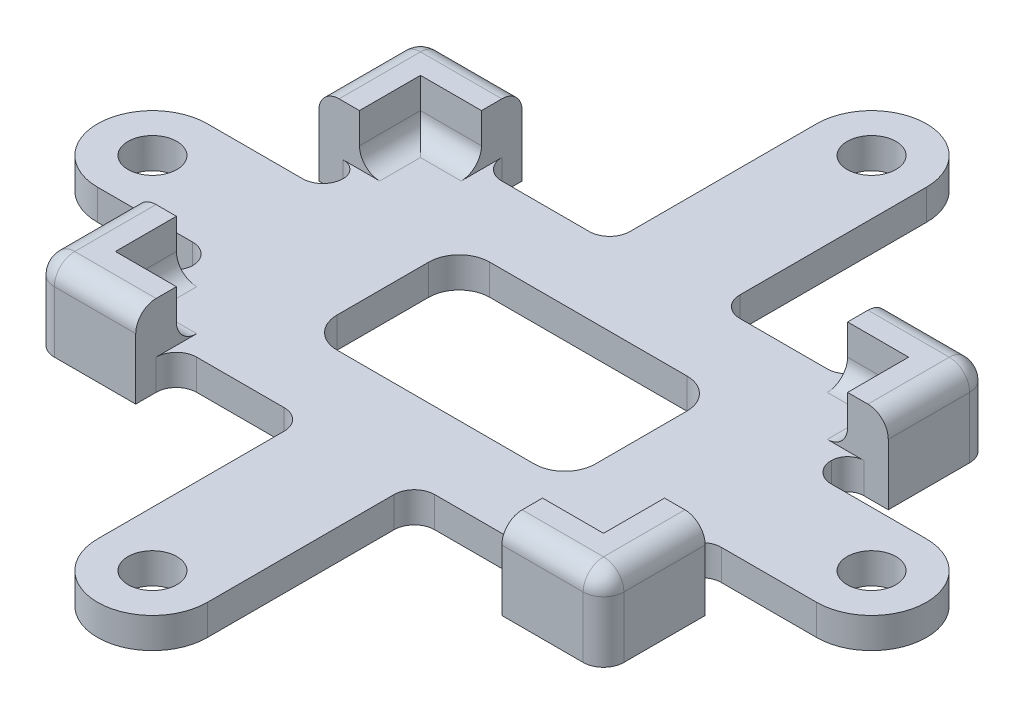
from build123d import *

# Parameters (mm, degrees)
SKETCH1_W            = 24
SKETCH1_H            = 15
BOSS_EXTRUDE1_DEPTH  = 0.75
BOSS_EXTRUDE2_START  = -1.5
BOSS_EXTRUDE2_DEPTH  = 4
MIRROR2_START        = -1.5
MIRROR2_COPY_1_DEPTH = 4
SKETCH3_R            = 1.2
BOSS_EXTRUDE3_DEPTH  = 1.5
FILLET1_R            = 1
BOSS_EXTRUDE4_DEPTH  = 1.5
SKETCH5_W            = 12.692307692
SKETCH5_H            = 7.5
CUT_EXTRUDE1_DEPTH   = 1.5
FILLET2_R            = 1.5


with BuildPart() as part:
    # Sketch1 → Boss-Extrude1 (new, symmetric)
    with BuildSketch(Plane(origin=(0, 0, 0), x_dir=(1, 0, 0), z_dir=(0, 1, 0))):
        Rectangle(SKETCH1_W, SKETCH1_H)
    extrude(amount=BOSS_EXTRUDE1_DEPTH, both=True)

    # Sketch2 → Boss-Extrude2 (add)
    with BuildSketch(Plane(origin=(0, 0.75, 0), x_dir=(1, 0, 0), z_dir=(0, 1, 0)).offset(BOSS_EXTRUDE2_START)):
        Polygon((-12, 4.5), (-14, 4.5), (-14, 9.5), (-9, 9.5), (-9, 7.5), (-12, 7.5), align=None)
    boss_extrude2 = extrude(amount=BOSS_EXTRUDE2_DEPTH)

    # Mirror1: Boss-Extrude2 across plane
    add(boss_extrude2.mirror(Plane(origin=(0, 0, 0), x_dir=(0, 0, 1), z_dir=(1, 0, 0))))

    # Mirror2: Boss-Extrude2 across plane
    add(boss_extrude2.mirror(Plane.XY))

    # Mirror2 copy 1 sketch → Mirror2 copy 1 (add)
    with BuildSketch(Plane(origin=(0, 0.75, 0), x_dir=(-1, 0, 0), z_dir=(0, 1, 0)).offset(MIRROR2_START)):
        Polygon((-12, 4.5), (-14, 4.5), (-14, 9.5), (-9, 9.5), (-9, 7.5), (-12, 7.5), align=None)
    extrude(amount=MIRROR2_COPY_1_DEPTH)

    # Sketch3 → Boss-Extrude3 (add)
    # profile 1 of 4: a face of its own
    with BuildSketch(Plane(origin=(0, 0.75, 0), x_dir=(1, 0, 0), z_dir=(0, 1, 0))):
        with BuildLine():
            Line((-17.67766953, 2.7), (-12, 2.7))
            Line((-12, 2.7), (-12, -2.7))
            Line((-12, -2.7), (-17.67766953, -2.7))
            ThreePointArc((-17.67766953, -2.7), (-20.37766953, 0), (-17.67766953, 2.7))
        make_face()
        with Locations(Location((-17.67766953, 0, 0), (0, 0, 270))):
            Circle(SKETCH3_R, mode=Mode.SUBTRACT)
    # profile 2 of 4: a face of its own
    with BuildSketch(Plane(origin=(0, 0.75, 0), x_dir=(1, 0, 0), z_dir=(0, 1, 0))):
        with BuildLine():
            Line((-2.7, 17.67766953), (-2.7, 7.5))
            Line((-2.7, 7.5), (2.7, 7.5))
            Line((2.7, 7.5), (2.7, 17.67766953))
            ThreePointArc((2.7, 17.67766953), (0, 20.37766953), (-2.7, 17.67766953))
        make_face()
        with Locations(Location((0, 17.67766953, 0), (0, 0, 270))):
            Circle(SKETCH3_R, mode=Mode.SUBTRACT)
    # profile 3 of 4: a face of its own
    with BuildSketch(Plane(origin=(0, 0.75, 0), x_dir=(1, 0, 0), z_dir=(0, 1, 0))):
        with BuildLine():
            Line((12, -2.7), (17.67766953, -2.7))
            ThreePointArc((17.67766953, -2.7), (20.37766953, 0), (17.67766953, 2.7))
            Line((17.67766953, 2.7), (12, 2.7))
            Line((12, 2.7), (12, -2.7))
        make_face()
        with Locations(Location((17.67766953, 0, 0), (0, 0, 90))):
            Circle(SKETCH3_R, mode=Mode.SUBTRACT)
    # profile 4 of 4: a face of its own
    with BuildSketch(Plane(origin=(0, 0.75, 0), x_dir=(1, 0, 0), z_dir=(0, 1, 0))):
        with BuildLine():
            Line((-2.7, -7.5), (2.7, -7.5))
            Line((2.7, -7.5), (2.7, -17.67766953))
            ThreePointArc((2.7, -17.67766953), (0, -20.37766953), (-2.7, -17.67766953))
            Line((-2.7, -17.67766953), (-2.7, -7.5))
        make_face()
        with Locations(Location((0, -17.67766953, 0), (0, 0, 90))):
            Circle(SKETCH3_R, mode=Mode.SUBTRACT)
    extrude(amount=-BOSS_EXTRUDE3_DEPTH)

    # Fillet1
    fillet1_edges = [part.edges().sort_by_distance(p)[0] for p in [
        (-14, 1.25, 9.5),
        (-14, 3.25, 7),
        (-11.5, 3.25, 9.5),
        (14, 1.25, 9.5),
        (11.5, 3.25, 9.5),
        (14, 3.25, 7),
        (14, 1.25, -9.5),
        (14, 3.25, -7),
        (11.5, 3.25, -9.5),
        (-11.5, 3.25, -9.5),
        (-14, 3.25, -7),
        (-14, 1.25, -9.5),
        (-10.5, 0.75, -7.5),
        (-12, 0.75, -6),
        (10.5, 0.75, -7.5),
        (12, 0.75, -6),
        (12, 0.75, 6),
        (10.5, 0.75, 7.5),
        (-10.5, 0.75, 7.5),
        (-12, 0.75, 6),
        (2.7, 0, -7.5),
        (-2.7, 0, -7.5),
        (-2.7, 0, 7.5),
        (2.7, 0, 7.5),
        (12, 0, 2.7),
        (12, 0, -2.7),
        (-12, 0, 2.7),
        (-12, 0, -2.7),
    ]]
    fillet(fillet1_edges, radius=FILLET1_R)

    # Sketch4 → Boss-Extrude4 (add)
    with BuildSketch(Plane(origin=(0, 0.75, 0), x_dir=(1, 0, 0), z_dir=(0, 1, 0))):
        with BuildLine():
            Line((-12.8, -4.5), (-12, -4.5))
            Line((-12, -4.5), (-12, -3.7))
            ThreePointArc((-12, -3.7), (-12.234314575, -4.265685425), (-12.8, -4.5))
        make_face()
        with BuildLine():
            Line((-12.8, 4.5), (-12, 4.5))
            Line((-12, 4.5), (-12, 3.7))
            ThreePointArc((-12, 3.7), (-12.234314575, 4.265685425), (-12.8, 4.5))
        make_face()
        with BuildLine():
            Line((12.8, 4.5), (12, 4.5))
            Line((12, 4.5), (12, 3.7))
            ThreePointArc((12, 3.7), (12.234314575, 4.265685425), (12.8, 4.5))
        make_face()
        with BuildLine():
            Line((12, -3.7), (12, -4.5))
            Line((12, -4.5), (12.8, -4.5))
            ThreePointArc((12.8, -4.5), (12.234314575, -4.265685425), (12, -3.7))
        make_face()
        with BuildLine():
            Line((-9, 8.5), (-9, 7.5))
            Line((-9, 7.5), (-8, 7.5))
            ThreePointArc((-8, 7.5), (-8.707106781, 7.792893219), (-9, 8.5))
        make_face()
        with BuildLine():
            Line((8, 7.5), (9, 7.5))
            Line((9, 7.5), (9, 8.5))
            ThreePointArc((9, 8.5), (8.707106781, 7.792893219), (8, 7.5))
        make_face()
        with BuildLine():
            Line((8, -7.5), (9, -7.5))
            Line((9, -7.5), (9, -8.5))
            ThreePointArc((9, -8.5), (8.707106781, -7.792893219), (8, -7.5))
        make_face()
        with BuildLine():
            Line((-9, -8.5), (-9, -7.5))
            Line((-9, -7.5), (-8, -7.5))
            ThreePointArc((-8, -7.5), (-8.707106781, -7.792893219), (-9, -8.5))
        make_face()
    extrude(amount=-BOSS_EXTRUDE4_DEPTH)

    # Sketch5 → Cut-Extrude1 (cut)
    with BuildSketch(Plane(origin=(0, 0.75, 0), x_dir=(1, 0, 0), z_dir=(0, 1, 0))):
        Rectangle(SKETCH5_W, SKETCH5_H)
    extrude(amount=-CUT_EXTRUDE1_DEPTH, mode=Mode.SUBTRACT)

    # Fillet2
    fillet2_edges = [part.edges().sort_by_distance(p)[0] for p in [
        (6.346153846, 0, 3.75),
        (6.346153846, 0, -3.75),
        (-6.346153846, 0, -3.75),
        (-6.346153846, 0, 3.75),
    ]]
    fillet(fillet2_edges, radius=FILLET2_R)


solid = part.part
